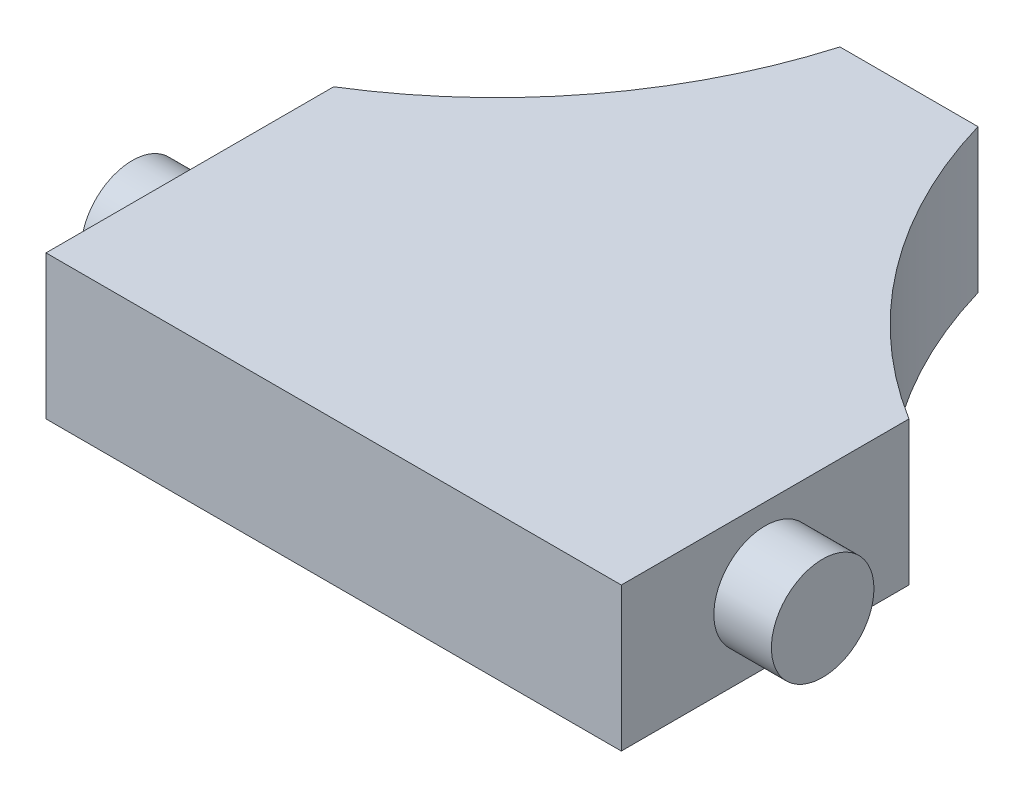
from build123d import *

# Parameters (mm, degrees)
SALIENTE_EXTRUIR1_DEPTH = 25
CROQUIS2_W              = 100
CROQUIS2_H              = 25
SALIENTE_EXTRUIR2_DEPTH = 50
CROQUIS3_R              = 8.912899487
SALIENTE_EXTRUIR3_DEPTH = 10


with BuildPart() as part:
    # Croquis1 → Saliente-Extruir1 (new body)
    with BuildSketch(Plane(origin=(0, 0, 0), x_dir=(1, 0, 0), z_dir=(0, 1, 0))):
        with BuildLine():
            Line((-50, 0), (50, 0))
            ThreePointArc((50, 0), (26.377279403, 21.486732346), (12, 50))
            Line((12, 50), (-12, 50))
            ThreePointArc((-12, 50), (-26.377279403, 21.486732346), (-50, 0))
        make_face()
    extrude(amount=SALIENTE_EXTRUIR1_DEPTH)

    # Croquis2 → Saliente-Extruir2 (add)
    with BuildSketch(Plane.XY):
        with Locations((0, 12.5)):
            Rectangle(CROQUIS2_W, CROQUIS2_H)
    extrude(amount=SALIENTE_EXTRUIR2_DEPTH)

    # Croquis3 → Saliente-Extruir3 (add)
    with BuildSketch(Plane(origin=(50, 0, 0), x_dir=(0, 0, -1), z_dir=(1, 0, 0))):
        with Locations((-25, 12.5)):
            Circle(CROQUIS3_R)
    saliente_extruir3 = extrude(amount=SALIENTE_EXTRUIR3_DEPTH)

    # Simetría1: Saliente-Extruir3 across plane
    add(saliente_extruir3.mirror(Plane(origin=(0, 0, 0), x_dir=(0, 0, 1), z_dir=(1, 0, 0))))


solid = part.part
